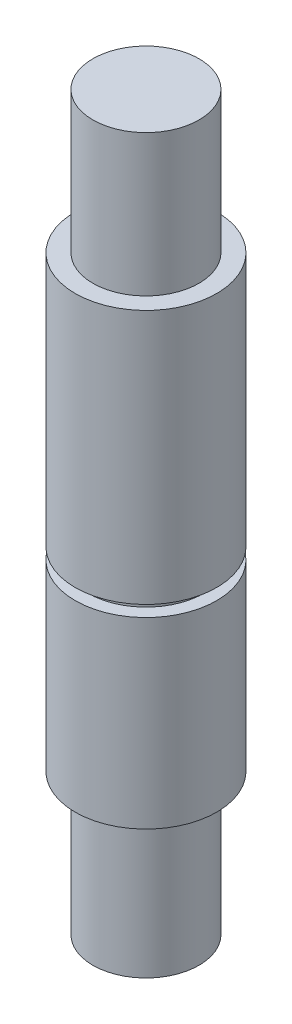
from build123d import *

# Parameters (mm, degrees)
SKETCH1_R           = 7.5
BOSS_EXTRUDE1_DEPTH = 20
SKETCH2_R           = 10
BOSS_EXTRUDE2_DEPTH = 63.5
SKETCH3_R           = 7.5
BOSS_EXTRUDE3_DEPTH = 20
CUT_EXTRUDE1_DEPTH  = 6
SKETCH5_W           = 1.8
SKETCH5_H           = 1.6


with BuildPart() as part:
    # Sketch1 → Boss-Extrude1 (new body)
    with BuildSketch(Plane(origin=(0, 0, 0), x_dir=(1, 0, 0), z_dir=(0, 1, 0))):
        with Locations(Location((0, 0, 0), (0, 0, 270))):
            Circle(SKETCH1_R)
    extrude(amount=BOSS_EXTRUDE1_DEPTH)

    # Sketch2 → Boss-Extrude2 (add)
    with BuildSketch(Plane(origin=(0, 20, 0), x_dir=(1, 0, 0), z_dir=(0, 1, 0))):
        with Locations(Location((0, 0, 0), (0, 0, 270))):
            Circle(SKETCH2_R)
    extrude(amount=BOSS_EXTRUDE2_DEPTH)

    # Sketch3 → Boss-Extrude3 (add)
    with BuildSketch(Plane(origin=(0, 83.5, 0), x_dir=(1, 0, 0), z_dir=(0, 1, 0))):
        with Locations(Location((0, 0, 0), (0, 0, 270))):
            Circle(SKETCH3_R)
    extrude(amount=BOSS_EXTRUDE3_DEPTH)

    # Sketch4 → Cut-Extrude1 (cut)
    with BuildSketch(Plane(origin=(0, 0, -10), x_dir=(-1, 0, 0), z_dir=(0, 0, -1))):
        with BuildLine():
            Line((-5, 75.5), (-5, 55.5))
            ThreePointArc((-5, 55.5), (0, 50.5), (5, 55.5))
            Line((5, 55.5), (5, 75.5))
            ThreePointArc((5, 75.5), (0, 80.5), (-5, 75.5))
        make_face()
    extrude(amount=-CUT_EXTRUDE1_DEPTH, mode=Mode.SUBTRACT)

    # Sketch5 → Cut-Revolve1 (revolve, cut)
    with BuildSketch(Plane(origin=(0, 0, 0), x_dir=(0, 0, -1), z_dir=(1, 0, 0)), mode=Mode.PRIVATE) as cut_revolve1_sk:
        with Locations((9.1, 46.7)):
            Rectangle(SKETCH5_W, SKETCH5_H)
    revolve(cut_revolve1_sk.sketch.rotate(Axis((0, 103.034047477, 0), (0, -1, 0)), 180), axis=Axis((0, 103.034047477, 0), (0, -1, 0)), mode=Mode.SUBTRACT)


solid = part.part
